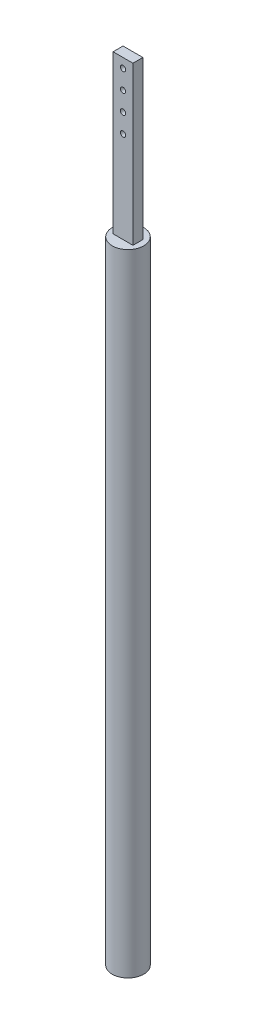
from build123d import *

# Parameters (mm, degrees)
SKETCH1_R           = 3.175
BOSS_EXTRUDE1_DEPTH = 127
SKETCH4_W           = 4.000000128
SKETCH4_H           = 2
BOSS_EXTRUDE2_DEPTH = 31.75
SKETCH5_R           = 0.5334
CUT_EXTRUDE1_DEPTH  = 2


with BuildPart() as part:
    # Sketch1 → Boss-Extrude1 (new body)
    with BuildSketch(Plane(origin=(0, 0, 0), x_dir=(1, 0, 0), z_dir=(0, 1, 0))):
        with Locations(Location((0, 0, 0), (0, 0, 270))):
            Circle(SKETCH1_R)
    extrude(amount=BOSS_EXTRUDE1_DEPTH)

    # Sketch4 → Boss-Extrude2 (add)
    with BuildSketch(Plane(origin=(0, 127, 0), x_dir=(1, 0, 0), z_dir=(0, 1, 0))):
        with Locations((6.4e-08, 0)):
            Rectangle(SKETCH4_W, SKETCH4_H)
    extrude(amount=BOSS_EXTRUDE2_DEPTH)

    # Sketch5 → Cut-Extrude1 (cut)
    with BuildSketch(Plane(origin=(0, 0, -1), x_dir=(-1, 0, 0), z_dir=(0, 0, -1))):
        with Locations((0, 156.845)):
            Circle(SKETCH5_R)
        with Locations((0, 153.035)):
            Circle(SKETCH5_R)
        with Locations((0, 149.225)):
            Circle(SKETCH5_R)
        with Locations((0, 145.415)):
            Circle(SKETCH5_R)
    extrude(amount=-CUT_EXTRUDE1_DEPTH, mode=Mode.SUBTRACT)


solid = part.part
